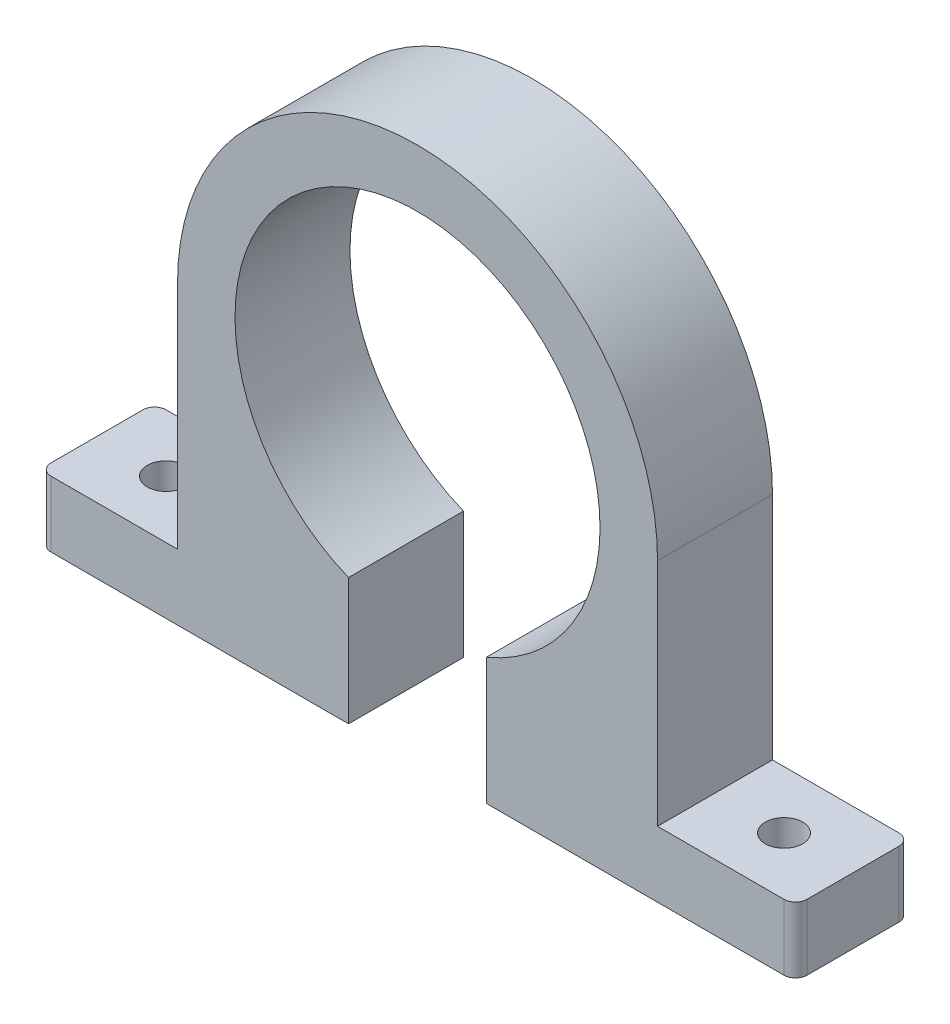
from build123d import *

# Parameters (mm, degrees)
BOSS_EXTRUDE1_DEPTH   = 10
FILLET1_R             = 1
F_4_CLEARANCE_HOLE1_D = 3.2639


with BuildPart() as part:
    # Sketch1 → Boss-Extrude1 (new body)
    with BuildSketch(Plane.XY):
        with BuildLine():
            Line((-20.875, 0), (-20.875, -20))
            Line((-20.875, -20), (-32.875, -20))
            Line((-32.875, -20), (-32.875, -25.72))
            Line((-32.875, -25.72), (-6, -25.72))
            Line((-6, -25.72), (-6, -14.69747002))
            ThreePointArc((-6, -14.69747002), (0, 15.875), (6, -14.69747002))
            Line((6, -14.69747002), (6, -25.72))
            Line((6, -25.72), (32.875, -25.72))
            Line((32.875, -25.72), (32.875, -20))
            Line((32.875, -20), (20.875, -20))
            Line((20.875, -20), (20.875, 0))
            ThreePointArc((20.875, 0), (0, 20.875), (-20.875, 0))
        make_face()
    extrude(amount=BOSS_EXTRUDE1_DEPTH)

    # Fillet1
    fillet1_edges = [part.edges().sort_by_distance(p)[0] for p in [
        (-32.875, -22.86, 0),
        (32.875, -22.86, 0),
        (32.875, -22.86, 10),
        (-32.875, -22.86, 10),
    ]]
    fillet(fillet1_edges, radius=FILLET1_R)

    # #4 Clearance Hole1 (through all)
    with Locations(Plane(origin=(0, -20, 0), x_dir=(1, 0, 0), z_dir=(0, 1, 0))):
        with Locations((-26.875, -5), (26.875, -5)):
            Hole(F_4_CLEARANCE_HOLE1_D / 2)


solid = part.part
